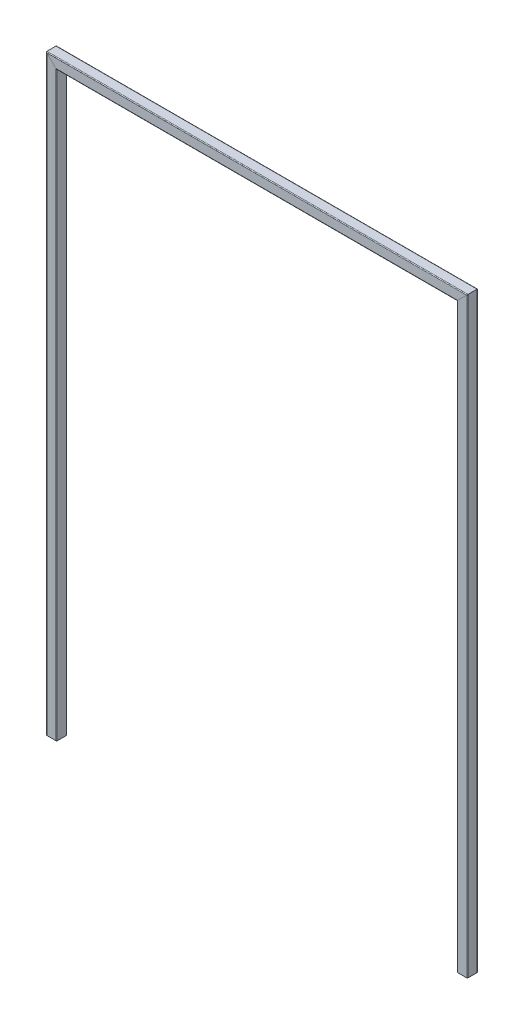
from build123d import *

# Parameters (mm, degrees)
TUBE_SQUARE_TS7X7X0_25_1_DEPTH   = 10126.723585695
TUBE_SQUARE_TS7X7X0_25_1_2_DEPTH = 7253.44717139
TUBE_SQUARE_TS7X7X0_25_1_3_DEPTH = 10126.723585696


with BuildPart() as part:
    # Sketch11 → Tube square TS7X7X0.25(1) (new body)
    with BuildSketch(Plane(origin=(0, 0, 0), x_dir=(-1, 0, 0), z_dir=(0, 1, 0))):
        with BuildLine():
            Line((-76.2, -88.9), (76.2, -88.9))
            ThreePointArc((76.2, -88.9), (85.180256121, -85.180256121), (88.9, -76.2))
            Line((88.9, -76.2), (88.9, 76.2))
            ThreePointArc((88.9, 76.2), (85.180256121, 85.180256121), (76.2, 88.9))
            Line((76.2, 88.9), (-76.2, 88.9))
            ThreePointArc((-76.2, 88.9), (-85.180256121, 85.180256121), (-88.9, 76.2))
            Line((-88.9, 76.2), (-88.9, -76.2))
            ThreePointArc((-88.9, -76.2), (-85.180256121, -85.180256121), (-76.2, -88.9))
        make_face()
        with BuildLine():
            Line((-76.2, -82.55), (76.2, -82.55))
            ThreePointArc((76.2, -82.55), (80.690128061, -80.690128061), (82.55, -76.2))
            Line((82.55, -76.2), (82.55, 76.2))
            ThreePointArc((82.55, 76.2), (80.690128061, 80.690128061), (76.2, 82.55))
            Line((76.2, 82.55), (-76.2, 82.55))
            ThreePointArc((-76.2, 82.55), (-80.690128061, 80.690128061), (-82.55, 76.2))
            Line((-82.55, 76.2), (-82.55, -76.2))
            ThreePointArc((-82.55, -76.2), (-80.690128061, -80.690128061), (-76.2, -82.55))
        make_face(mode=Mode.SUBTRACT)
    extrude(amount=TUBE_SQUARE_TS7X7X0_25_1_DEPTH)

    # Tube square TS7X7X0.25(1) mitre 1
    split(bisect_by=Plane(origin=(0, 10000, 0), x_dir=(0.707106781, -0.707106781, 0), z_dir=(-0.707106781, -0.707106781, 0)), keep=Keep.TOP)


with BuildPart() as body_2:
    # Sketch11 on segment 2 (carried to segment 2) → Tube square TS7X7X0.25_1 2 (new body)
    with BuildSketch(Plane(origin=(-126.723585695, 10000, 0), x_dir=(0, 1, 0), z_dir=(1, 0, 0))):
        with BuildLine():
            Line((-76.2, -88.9), (76.2, -88.9))
            ThreePointArc((76.2, -88.9), (85.180256121, -85.180256121), (88.9, -76.2))
            Line((88.9, -76.2), (88.9, 76.2))
            ThreePointArc((88.9, 76.2), (85.180256121, 85.180256121), (76.2, 88.9))
            Line((76.2, 88.9), (-76.2, 88.9))
            ThreePointArc((-76.2, 88.9), (-85.180256121, 85.180256121), (-88.9, 76.2))
            Line((-88.9, 76.2), (-88.9, -76.2))
            ThreePointArc((-88.9, -76.2), (-85.180256121, -85.180256121), (-76.2, -88.9))
        make_face()
        with BuildLine():
            Line((-76.2, -82.55), (76.2, -82.55))
            ThreePointArc((76.2, -82.55), (80.690128061, -80.690128061), (82.55, -76.2))
            Line((82.55, -76.2), (82.55, 76.2))
            ThreePointArc((82.55, 76.2), (80.690128061, 80.690128061), (76.2, 82.55))
            Line((76.2, 82.55), (-76.2, 82.55))
            ThreePointArc((-76.2, 82.55), (-80.690128061, 80.690128061), (-82.55, 76.2))
            Line((-82.55, 76.2), (-82.55, -76.2))
            ThreePointArc((-82.55, -76.2), (-80.690128061, -80.690128061), (-76.2, -82.55))
        make_face(mode=Mode.SUBTRACT)
    extrude(amount=TUBE_SQUARE_TS7X7X0_25_1_2_DEPTH)

    # Tube square TS7X7X0.25_1 2 mitre 1
    split(bisect_by=Plane(origin=(0, 10000, 0), x_dir=(-0.707106781, 0.707106781, 0), z_dir=(0.707106781, 0.707106781, 0)), keep=Keep.TOP)

    # Tube square TS7X7X0.25_1 2 mitre 2
    split(bisect_by=Plane(origin=(7000, 10000, 0), x_dir=(-0.707106781, -0.707106781, 0), z_dir=(-0.707106781, 0.707106781, 0)), keep=Keep.TOP)


with BuildPart() as body_3:
    # Sketch11 on segment 3 (carried to segment 3) → Tube square TS7X7X0.25_1 3 (new body)
    with BuildSketch(Plane(origin=(7000, 10126.723585695, 0), x_dir=(1, 0, 0), z_dir=(0, -1, 0))):
        with BuildLine():
            Line((-76.2, -88.9), (76.2, -88.9))
            ThreePointArc((76.2, -88.9), (85.180256121, -85.180256121), (88.9, -76.2))
            Line((88.9, -76.2), (88.9, 76.2))
            ThreePointArc((88.9, 76.2), (85.180256121, 85.180256121), (76.2, 88.9))
            Line((76.2, 88.9), (-76.2, 88.9))
            ThreePointArc((-76.2, 88.9), (-85.180256121, 85.180256121), (-88.9, 76.2))
            Line((-88.9, 76.2), (-88.9, -76.2))
            ThreePointArc((-88.9, -76.2), (-85.180256121, -85.180256121), (-76.2, -88.9))
        make_face()
        with BuildLine():
            Line((-76.2, -82.55), (76.2, -82.55))
            ThreePointArc((76.2, -82.55), (80.690128061, -80.690128061), (82.55, -76.2))
            Line((82.55, -76.2), (82.55, 76.2))
            ThreePointArc((82.55, 76.2), (80.690128061, 80.690128061), (76.2, 82.55))
            Line((76.2, 82.55), (-76.2, 82.55))
            ThreePointArc((-76.2, 82.55), (-80.690128061, 80.690128061), (-82.55, 76.2))
            Line((-82.55, 76.2), (-82.55, -76.2))
            ThreePointArc((-82.55, -76.2), (-80.690128061, -80.690128061), (-76.2, -82.55))
        make_face(mode=Mode.SUBTRACT)
    extrude(amount=TUBE_SQUARE_TS7X7X0_25_1_3_DEPTH)

    # Tube square TS7X7X0.25_1 3 mitre 1
    split(bisect_by=Plane(origin=(7000, 10000, 0), x_dir=(0.707106781, 0.707106781, 0), z_dir=(0.707106781, -0.707106781, 0)), keep=Keep.TOP)


solid = Compound([part.part, body_2.part, body_3.part])
